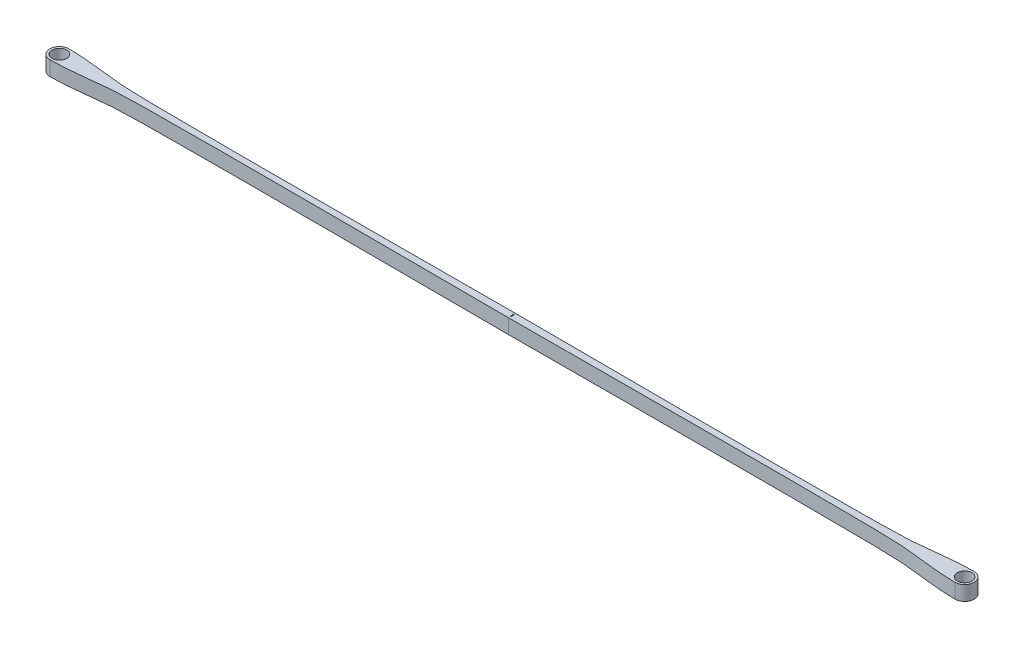
from build123d import *

# Parameters (mm, degrees)
BOSS_EXTRUDE1_DEPTH = 2
SKETCH3_R           = 1
CUT_EXTRUDE1_DEPTH  = 62.945944389
SKETCH4_W           = 0.1
SKETCH4_H           = 0.5
CUT_EXTRUDE2_DEPTH  = 0.5


with BuildPart() as part:
    # Sketch2 → Boss-Extrude1 (new body)
    with BuildSketch(Plane(origin=(0, 0, 0), x_dir=(1, 0, 0), z_dir=(0, 1, 0))):
        with BuildLine():
            Line((61.9, -0.5), (61.9, 0.5))
            add(Edge.make_bspline(
                [(0, 1.300005072), (2.158295669, 1.300005072), (7.605925173, 0.548342251), (11.061575129, 0.324012224), (61.9, 0.5)],
                knots=[0, 0, 0, 0, 0.427834461, 1, 1, 1, 1], degree=3))
            ThreePointArc((0, 1.300005072), (0.919242402, 0.919242402), (1.300005072, 0))
            ThreePointArc((1.300005072, 0), (0.919242402, -0.919242402), (0, -1.300005072))
            add(Edge.make_bspline(
                [(0, -1.300005072), (2.158295669, -1.300005072), (7.605925173, -0.548342251), (11.061575129, -0.324012224), (61.9, -0.5)],
                knots=[0, 0, 0, 0, 0.427834461, 1, 1, 1, 1], degree=3))
        make_face()
        with BuildLine():
            ThreePointArc((1.300005072, 0), (0.919242402, 0.919242402), (0, 1.300005072))
            ThreePointArc((0, 1.300005072), (-1.300005072, 0), (0, -1.300005072))
            ThreePointArc((0, -1.300005072), (0.919242402, -0.919242402), (1.300005072, 0))
        make_face()
    boss_extrude1 = extrude(amount=BOSS_EXTRUDE1_DEPTH)

    # Sketch3 → Cut-Extrude1 (cut, through all)
    with BuildSketch(Plane(origin=(0, 2, 0), x_dir=(1, 0, 0), z_dir=(0, 1, 0))):
        with Locations(Location((0, 0, 0), (0, 0, 270))):
            Circle(SKETCH3_R)
    cut_extrude1 = extrude(amount=-CUT_EXTRUDE1_DEPTH, mode=Mode.SUBTRACT)

    # Mirror1: Boss-Extrude1, Cut-Extrude1 across plane
    add(boss_extrude1.mirror(Plane(origin=(61.9, 0, 0), x_dir=(0, 0, 1), z_dir=(1, 0, 0))))
    add(cut_extrude1.mirror(Plane(origin=(61.9, 0, 0), x_dir=(0, 0, 1), z_dir=(1, 0, 0))), mode=Mode.SUBTRACT)

    # Sketch4 → Cut-Extrude2 (cut)
    with BuildSketch(Plane(origin=(0, 2, 0), x_dir=(1, 0, 0), z_dir=(0, 1, 0))):
        with Locations((61.9, 0.049994928)):
            Rectangle(SKETCH4_W, SKETCH4_H)
    extrude(amount=-CUT_EXTRUDE2_DEPTH, mode=Mode.SUBTRACT)


solid = part.part
